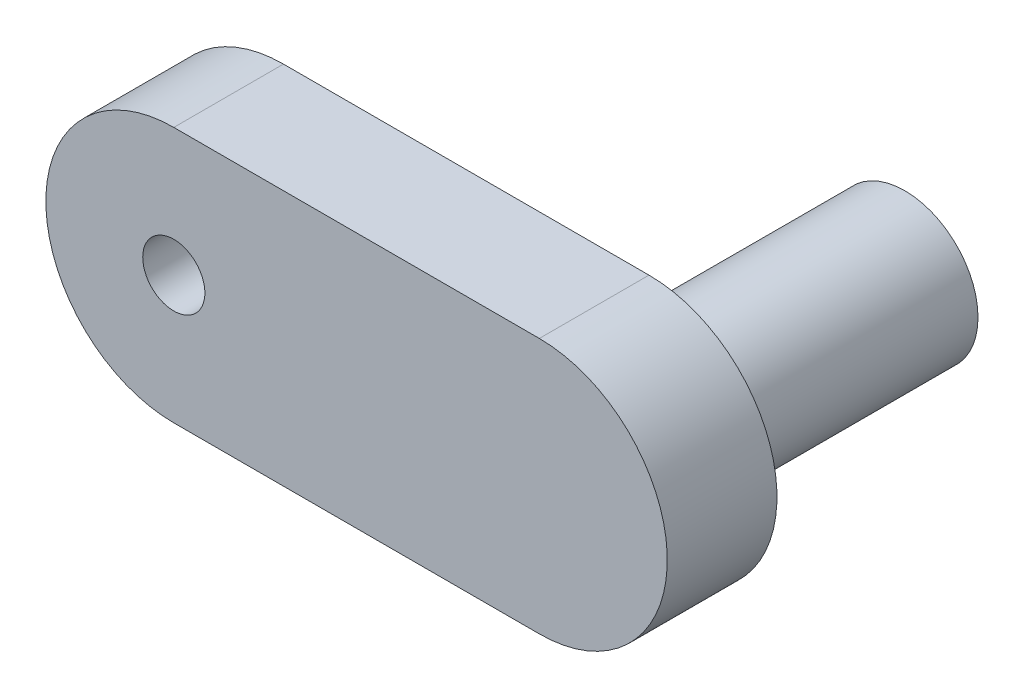
from build123d import *

# Parameters (mm, degrees)
RESSALTO_EXTRUS_O1_DEPTH = 1.5
ESBO_O2_R                = 2
RESSALTO_EXTRUS_O2_DEPTH = 7
CORTE_EXTRUS_O1_REACH    = 17.604
ESBO_O3_R                = 0.85


with BuildPart() as part:
    # Esboço1 → Ressalto-extrusão1 (new, symmetric)
    with BuildSketch(Plane.XY):
        with BuildLine():
            Line((0, 3.5), (10, 3.5))
            ThreePointArc((10, 3.5), (13.5, 0), (10, -3.5))
            Line((10, -3.5), (0, -3.5))
            ThreePointArc((0, -3.5), (-3.5, 0), (0, 3.5))
        make_face()
    extrude(amount=RESSALTO_EXTRUS_O1_DEPTH, both=True)

    # Esboço2 → Ressalto-extrusão2 (add)
    with BuildSketch(Plane(origin=(0, 0, -1.5), x_dir=(-1, 0, 0), z_dir=(0, 0, -1))):
        with Locations(Location((-10, 0, 0), (0, 0, 180))):
            Circle(ESBO_O2_R)
    extrude(amount=RESSALTO_EXTRUS_O2_DEPTH)

    # Esboço3 → Corte-extrusão1 (cut, up to next)
    with BuildSketch(Plane(origin=(0, 0, -1.5), x_dir=(-1, 0, 0), z_dir=(0, 0, -1)), mode=Mode.PRIVATE) as corte_extrus_o1_sk1:
        Circle(ESBO_O3_R)
    corte_extrus_o1_tool1 = extrude(corte_extrus_o1_sk1.sketch, amount=-CORTE_EXTRUS_O1_REACH, mode=Mode.PRIVATE) & part.part
    add(corte_extrus_o1_tool1.solids().sort_by_distance((0, 0, -1.5))[0], mode=Mode.SUBTRACT)


solid = part.part
